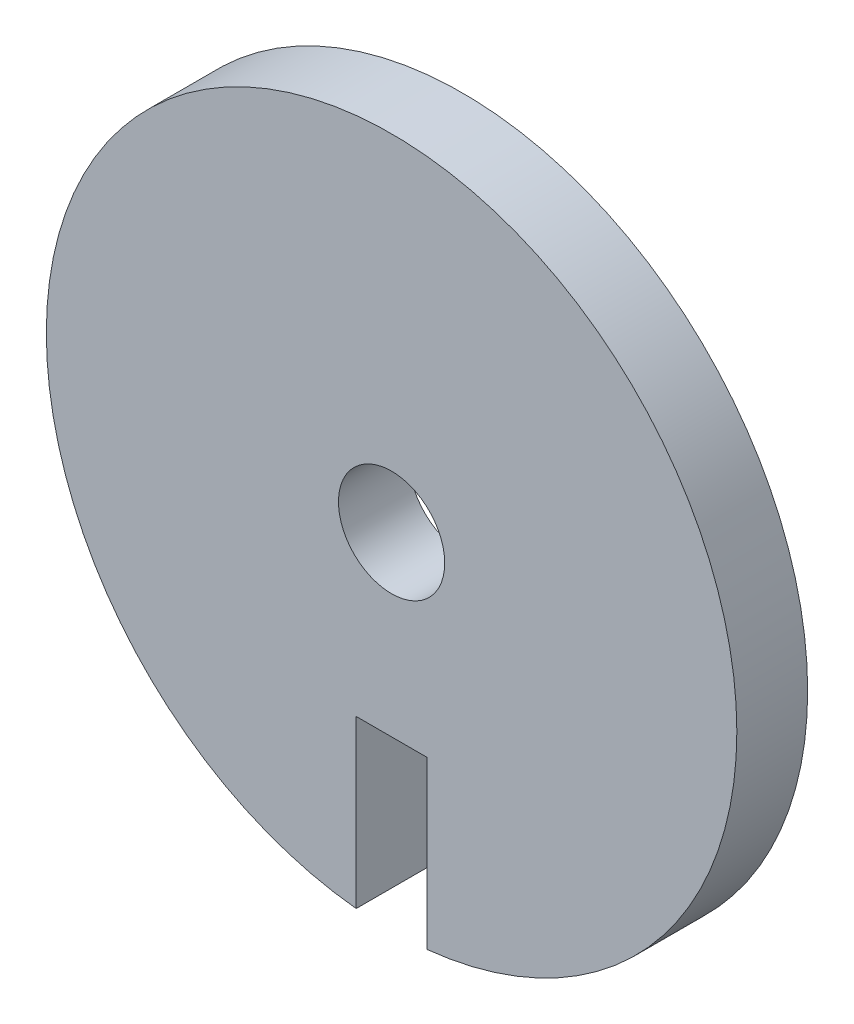
from build123d import *

# Parameters (mm, degrees)
SKIZZE1_R                       = 19.5
AUFSATZ_LINEAR_AUSTRAGEN1_DEPTH = 4
SKIZZE4_R                       = 3
SCHNITT_LINEAR_AUSTRAGEN2_DEPTH = 4
SKIZZE6_W                       = 4
SKIZZE6_H                       = 10
SCHNITT_LINEAR_AUSTRAGEN3_DEPTH = 4


with BuildPart() as part:
    # Skizze1 → Aufsatz-Linear austragen1 (new body)
    with BuildSketch(Plane.XY):
        Circle(SKIZZE1_R)
    extrude(amount=AUFSATZ_LINEAR_AUSTRAGEN1_DEPTH)

    # Skizze4 → Schnitt-Linear austragen2 (cut)
    with BuildSketch(Plane.XY.offset(4)):
        Circle(SKIZZE4_R)
    extrude(amount=-SCHNITT_LINEAR_AUSTRAGEN2_DEPTH, mode=Mode.SUBTRACT)

    # Skizze6 → Schnitt-Linear austragen3 (cut)
    with BuildSketch(Plane.XY.offset(4)):
        with Locations((0, -15)):
            Rectangle(SKIZZE6_W, SKIZZE6_H)
    extrude(amount=-SCHNITT_LINEAR_AUSTRAGEN3_DEPTH, mode=Mode.SUBTRACT)


solid = part.part
